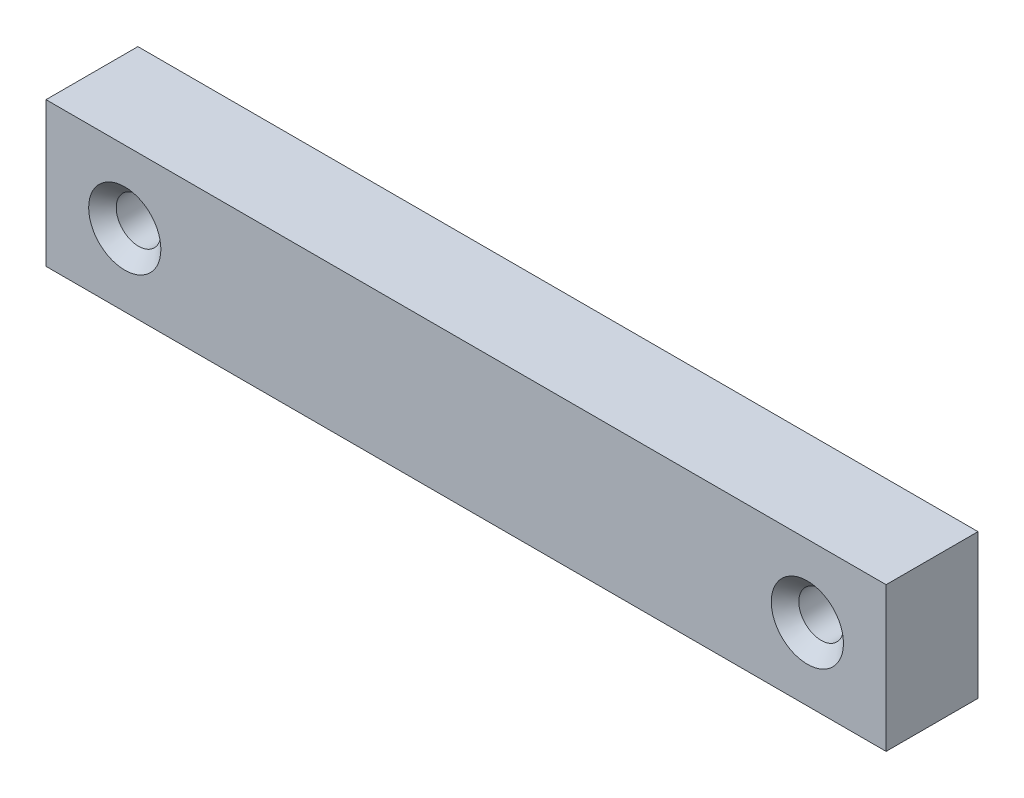
from build123d import *

# Parameters (mm, degrees)
SKETCH1_W           = 64
SKETCH1_H           = 11
BOSS_EXTRUDE1_DEPTH = 7
SKETCH3_R           = 1.7
CUT_EXTRUDE1_DEPTH  = 66.314623171


with BuildPart() as part:
    # Sketch1 → Boss-Extrude1 (new body)
    with BuildSketch(Plane.XY):
        with Locations((32, 5.5)):
            Rectangle(SKETCH1_W, SKETCH1_H)
    extrude(amount=-BOSS_EXTRUDE1_DEPTH)

    # Sketch3 → Cut-Extrude1 (cut, through all)
    with BuildSketch(Plane.XY):
        with Locations((6, 5.5)):
            Circle(SKETCH3_R)
        with Locations((58, 5.5)):
            Circle(SKETCH3_R)
    extrude(amount=-CUT_EXTRUDE1_DEPTH, mode=Mode.SUBTRACT)

    # Sketch7 → Cut-Revolve1 (revolve, cut)
    with BuildSketch(Plane(origin=(0, 5.5, 0), x_dir=(1, 0, 0), z_dir=(0, 1, 0)), mode=Mode.PRIVATE) as cut_revolve1_sk:
        Polygon((3.25, 0), (6, 0), (6, 2.75), align=None)
    cut_revolve1 = revolve(cut_revolve1_sk.sketch.rotate(Axis((6, 5.5, -2.75), (0, 0, 1)), 180), axis=Axis((6, 5.5, -2.75), (0, 0, 1)), mode=Mode.SUBTRACT)

    # Mirror1: Cut-Revolve1 across plane
    add(cut_revolve1.mirror(Plane(origin=(32, 0, 0), x_dir=(0, 0, 1), z_dir=(1, 0, 0))), mode=Mode.SUBTRACT)


solid = part.part
